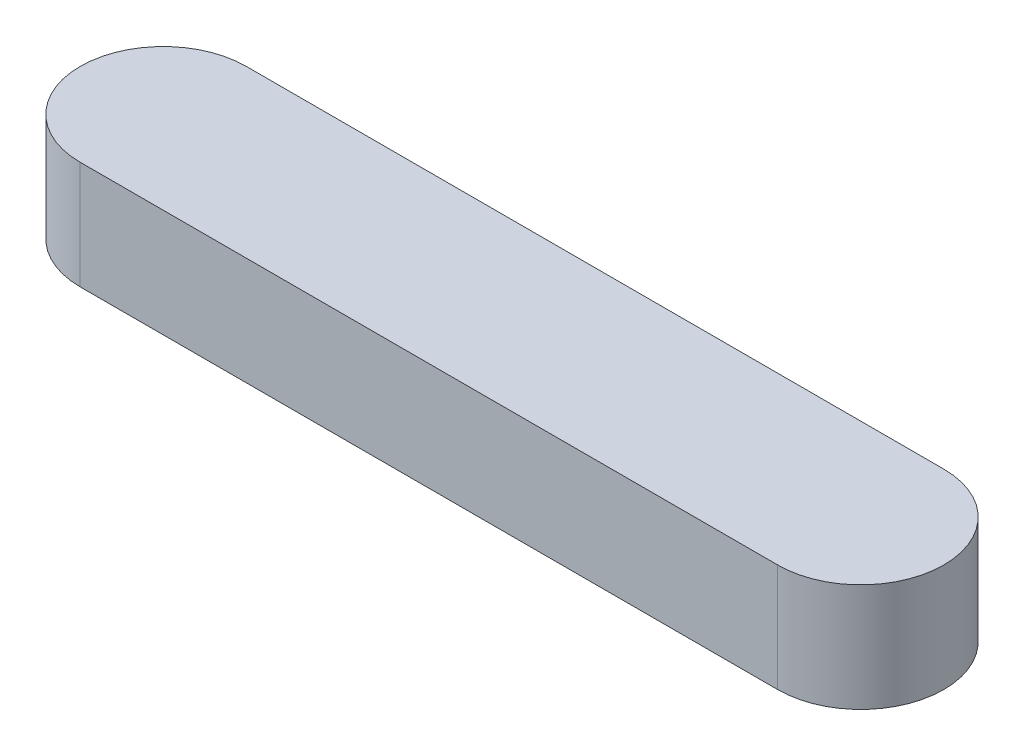
from build123d import *

# Parameters (mm, degrees)
BOSS_EXTRUDE1_DEPTH = 6.5


with BuildPart() as part:
    # Sketch1 → Boss-Extrude1 (new body)
    with BuildSketch(Plane(origin=(0, 0, 0), x_dir=(1, 0, 0), z_dir=(0, 1, 0))):
        with BuildLine():
            Line((-21, 5), (21, 5))
            ThreePointArc((21, 5), (26, 0), (21, -5))
            Line((21, -5), (-21, -5))
            ThreePointArc((-21, -5), (-26, 0), (-21, 5))
        make_face()
    extrude(amount=BOSS_EXTRUDE1_DEPTH)


solid = part.part
